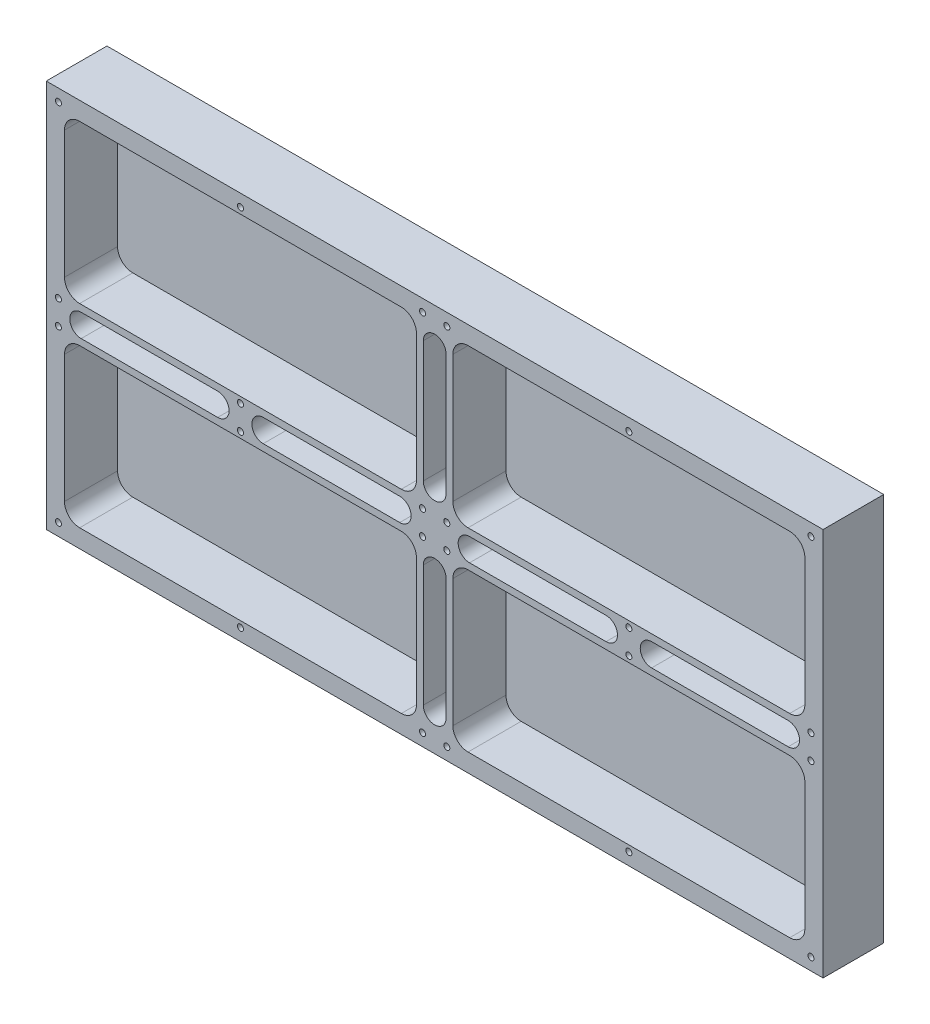
from build123d import *

# Parameters (mm, degrees)
SKIZZE1_W                                            = 512
SKIZZE1_H                                            = 256
AUFSATZ_LINEAR_AUSTRAGEN1_DEPTH                      = 40
SKIZZE2_W                                            = 488
SKIZZE2_H                                            = 232
SCHNITT_LINEAR_AUSTRAGEN1_DEPTH                      = 35
AUFSATZ_LINEAR_AUSTRAGEN2_DEPTH                      = 35
STIRNSENKUNG_F_R_M3_ZYLINDERSCHRAUBE_MIT_D           = 4
STIRNSENKUNG_F_R_M3_ZYLINDERSCHRAUBE_MIT_CBORE_D     = 6.5
STIRNSENKUNG_F_R_M3_ZYLINDERSCHRAUBE_MIT_CBORE_DEPTH = 3.4
VERRUNDUNG1_R                                        = 10
SCHNITT_LINEAR_AUSTRAGEN2_DEPTH                      = 35
SPIEGELN7_COPY_1_DEPTH                               = 35
SCHNITT_LINEAR_AUSTRAGEN3_DEPTH                      = 35


with BuildPart() as part:
    # Skizze1 → Aufsatz-Linear austragen1 (new body)
    with BuildSketch(Plane.XY):
        with Locations((256, 128)):
            Rectangle(SKIZZE1_W, SKIZZE1_H)
    extrude(amount=AUFSATZ_LINEAR_AUSTRAGEN1_DEPTH)

    # Skizze2 → Schnitt-Linear austragen1 (cut)
    with BuildSketch(Plane.XY.offset(40)):
        with Locations((256, 128)):
            Rectangle(SKIZZE2_W, SKIZZE2_H)
    extrude(amount=-SCHNITT_LINEAR_AUSTRAGEN1_DEPTH, mode=Mode.SUBTRACT)

    # Skizze5 → Aufsatz-Linear austragen2 (add)
    with BuildSketch(Plane.XY.offset(5)):
        Polygon((12, 140), (244, 140), (244, 244), (268, 244), (268, 140), (500, 140), (500, 116), (268, 116), (268, 12), (244, 12), (244, 116), (12, 116), align=None)
    extrude(amount=AUFSATZ_LINEAR_AUSTRAGEN2_DEPTH)

    # Stirnsenkung für M3 Zylinderschraube mit Innensechskant1 (through all)
    with Locations(Plane(origin=(0, 0, 0), x_dir=(1, 0, 0), z_dir=(0, 0, -1))):
        with Locations((8, -248), (128, -248), (248, -248), (264, -248), (384, -248), (384, -8), (264, -8), (128, -8), (504, -248), (504, -8), (8, -8), (384, -136), (264, -136), (128, -136), (128, -120), (264, -120), (384, -120), (248, -136), (248, -120), (248, -8), (504, -136), (504, -120), (8, -136), (8, -120)):
            CounterBoreHole(STIRNSENKUNG_F_R_M3_ZYLINDERSCHRAUBE_MIT_D / 2, STIRNSENKUNG_F_R_M3_ZYLINDERSCHRAUBE_MIT_CBORE_D / 2, STIRNSENKUNG_F_R_M3_ZYLINDERSCHRAUBE_MIT_CBORE_DEPTH)

    # Verrundung1
    verrundung1_edges = [part.edges().sort_by_distance(p)[0] for p in [
        (12, 244, 22.5),
        (500, 244, 22.5),
        (500, 12, 22.5),
        (12, 12, 22.5),
        (244, 140, 22.5),
        (244, 244, 22.5),
        (268, 244, 22.5),
        (268, 140, 22.5),
        (500, 140, 22.5),
        (500, 116, 22.5),
        (268, 116, 22.5),
        (268, 12, 22.5),
        (244, 12, 22.5),
        (244, 116, 22.5),
        (12, 116, 22.5),
        (12, 140, 22.5),
    ]]
    fillet(verrundung1_edges, radius=VERRUNDUNG1_R)

    # Skizze6 → Schnitt-Linear austragen2 (cut)
    with BuildSketch(Plane.XY.offset(40)):
        with BuildLine():
            Line((489, 120.5), (399, 120.5))
            ThreePointArc((399, 120.5), (391.5, 128), (399, 135.5))
            Line((399, 135.5), (489, 135.5))
            ThreePointArc((489, 135.5), (496.5, 128), (489, 120.5))
        make_face()
    schnitt_linear_austragen2 = extrude(amount=-SCHNITT_LINEAR_AUSTRAGEN2_DEPTH, mode=Mode.SUBTRACT)

    # Skizzen-Muster1: Schnitt-Linear austragen2 at 1 more place
    with Locations((-120, 0, 0)):
        add(schnitt_linear_austragen2, mode=Mode.SUBTRACT)

    # Spiegeln7: Schnitt-Linear austragen2 across plane
    add(schnitt_linear_austragen2.mirror(Plane.ZY.offset(-256)), mode=Mode.SUBTRACT)

    # Spiegeln7 copy 1 sketch → Spiegeln7 copy 1 (cut)
    with BuildSketch(Plane(origin=(632, 0, 40), x_dir=(-1, 0, 0), z_dir=(0, 0, 1))):
        with BuildLine():
            Line((489, -120.5), (399, -120.5))
            ThreePointArc((399, -120.5), (391.5, -128), (399, -135.5))
            Line((399, -135.5), (489, -135.5))
            ThreePointArc((489, -135.5), (496.5, -128), (489, -120.5))
        make_face()
    extrude(amount=-SPIEGELN7_COPY_1_DEPTH, mode=Mode.SUBTRACT)

    # Skizze9 → Schnitt-Linear austragen3 (cut)
    with BuildSketch(Plane.XY.offset(40)):
        with BuildLine():
            Line((263.5, 232), (263.5, 152))
            ThreePointArc((263.5, 152), (256, 144.5), (248.5, 152))
            Line((248.5, 152), (248.5, 232))
            ThreePointArc((248.5, 232), (256, 239.5), (263.5, 232))
        make_face()
    schnitt_linear_austragen3 = extrude(amount=-SCHNITT_LINEAR_AUSTRAGEN3_DEPTH, mode=Mode.SUBTRACT)

    # Spiegeln8: Schnitt-Linear austragen3 across plane
    add(schnitt_linear_austragen3.mirror(Plane.ZX.offset(128)), mode=Mode.SUBTRACT)


solid = part.part
